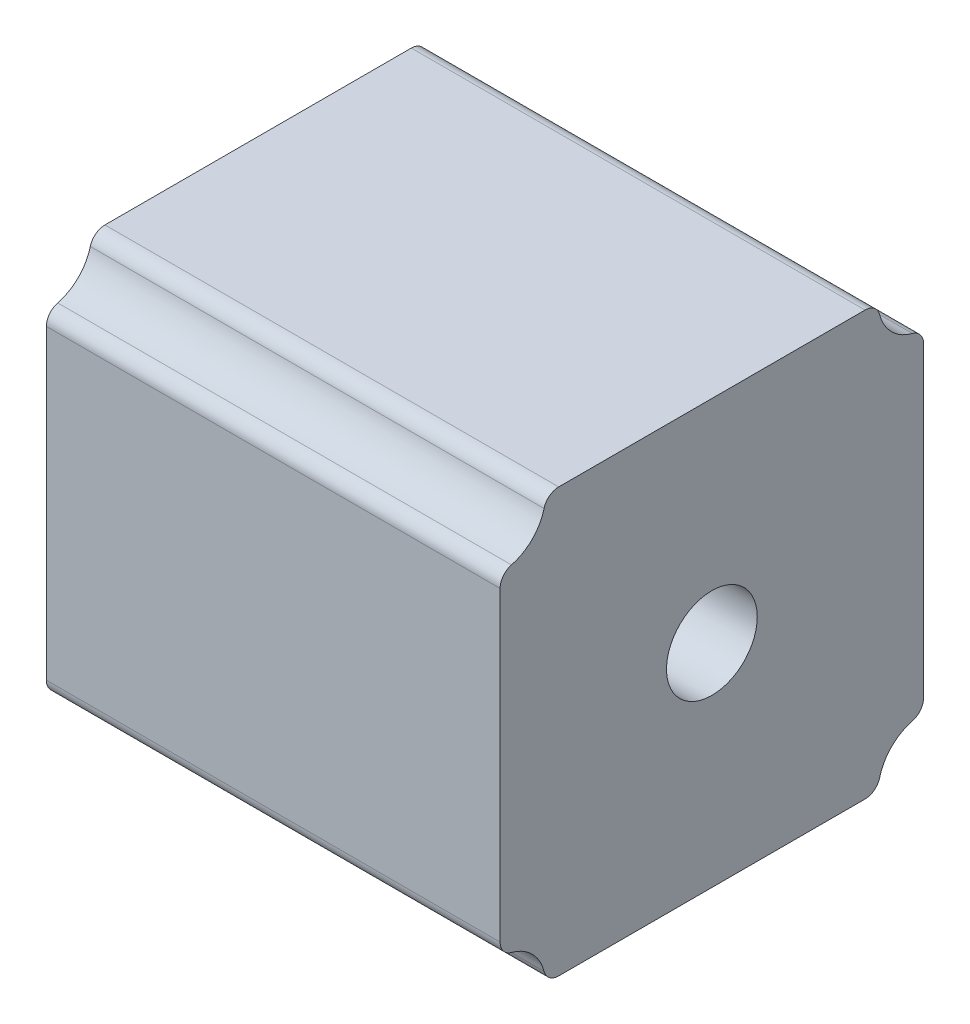
from build123d import *

# Parameters (mm, degrees)
EXTRUDE_1_DEPTH     = 30
SKETCH_2_R          = 3
CUT_EXTRUDE_1_DEPTH = 5


with BuildPart() as part:
    # 草图1 → 凸台-拉伸1 (new body)
    with BuildSketch(Plane(origin=(0, 0, 0), x_dir=(0, 0, -1), z_dir=(1, 0, 0))):
        with BuildLine():
            Line((-14, 10.127016654), (-14, -10.127016654))
            ThreePointArc((-14, -10.127016654), (-13.790569415, -10.739389089), (-13.25, -11.09526249))
            ThreePointArc((-13.25, -11.09526249), (-11.878679656, -11.878679656), (-11.09526249, -13.25))
            ThreePointArc((-11.09526249, -13.25), (-10.739389089, -13.790569415), (-10.127016654, -14))
            Line((-10.127016654, -14), (10.127016654, -14))
            ThreePointArc((10.127016654, -14), (10.739389089, -13.790569415), (11.09526249, -13.25))
            ThreePointArc((11.09526249, -13.25), (11.878679656, -11.878679656), (13.25, -11.09526249))
            ThreePointArc((13.25, -11.09526249), (13.790569415, -10.739389089), (14, -10.127016654))
            Line((14, -10.127016654), (14, 10.127016654))
            ThreePointArc((14, 10.127016654), (13.790569415, 10.739389089), (13.25, 11.09526249))
            ThreePointArc((13.25, 11.09526249), (11.878679656, 11.878679656), (11.09526249, 13.25))
            ThreePointArc((11.09526249, 13.25), (10.739389089, 13.790569415), (10.127016654, 14))
            Line((10.127016654, 14), (-10.127016654, 14))
            ThreePointArc((-10.127016654, 14), (-10.739389089, 13.790569415), (-11.09526249, 13.25))
            ThreePointArc((-11.09526249, 13.25), (-11.878679656, 11.878679656), (-13.25, 11.09526249))
            ThreePointArc((-13.25, 11.09526249), (-13.790569415, 10.739389089), (-14, 10.127016654))
        make_face()
    extrude(amount=-EXTRUDE_1_DEPTH)

    # 草图2 → 切除-拉伸1 (cut)
    with BuildSketch(Plane(origin=(0, 0, 0), x_dir=(0, 0, -1), z_dir=(1, 0, 0))):
        Circle(SKETCH_2_R)
    extrude(amount=-CUT_EXTRUDE_1_DEPTH, mode=Mode.SUBTRACT)


solid = part.part
